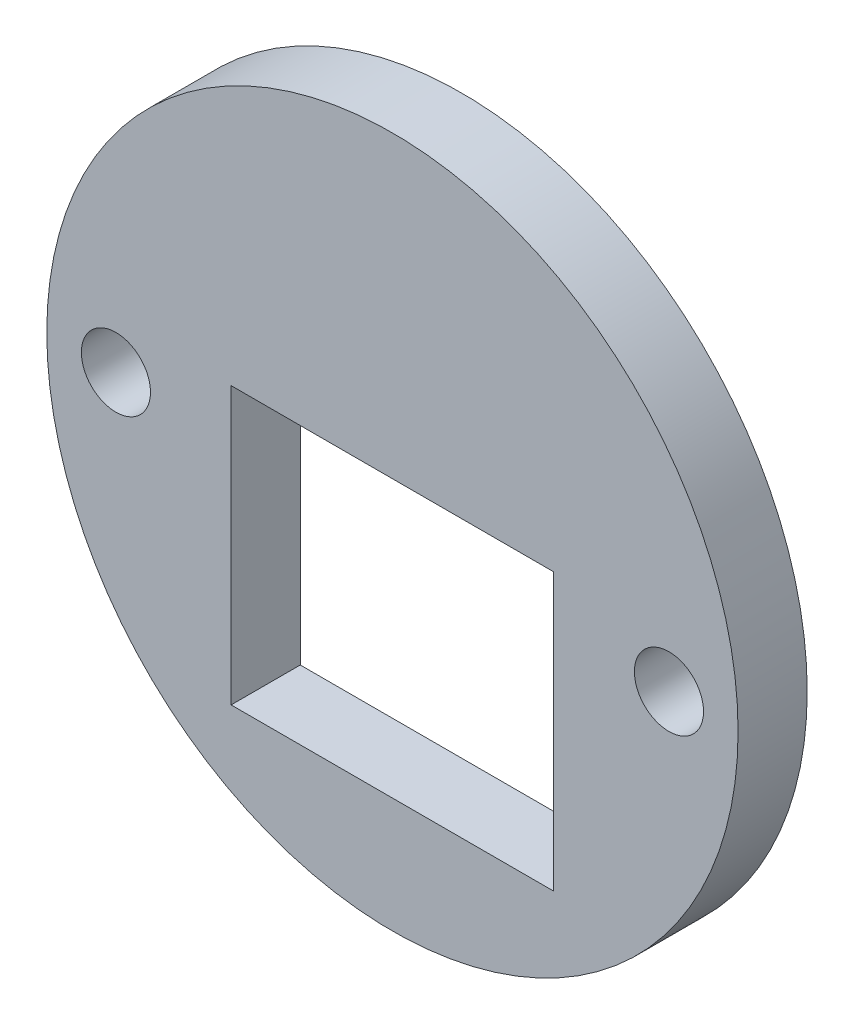
from build123d import *

# Parameters (mm, degrees)
SKETCH1_R           = 15
SKETCH1_R_2         = 1.5
SKETCH1_W           = 14
SKETCH1_H           = 12
BOSS_EXTRUDE1_DEPTH = 3


with BuildPart() as part:
    # Sketch1 → Boss-Extrude1 (new body)
    with BuildSketch(Plane.XY):
        Circle(SKETCH1_R)
        with Locations((-12, 0)):
            Circle(SKETCH1_R_2, mode=Mode.SUBTRACT)
        with Locations((12, 0)):
            Circle(SKETCH1_R_2, mode=Mode.SUBTRACT)
        with Locations((0, -4)):
            Rectangle(SKETCH1_W, SKETCH1_H, mode=Mode.SUBTRACT)
    extrude(amount=BOSS_EXTRUDE1_DEPTH)


solid = part.part
